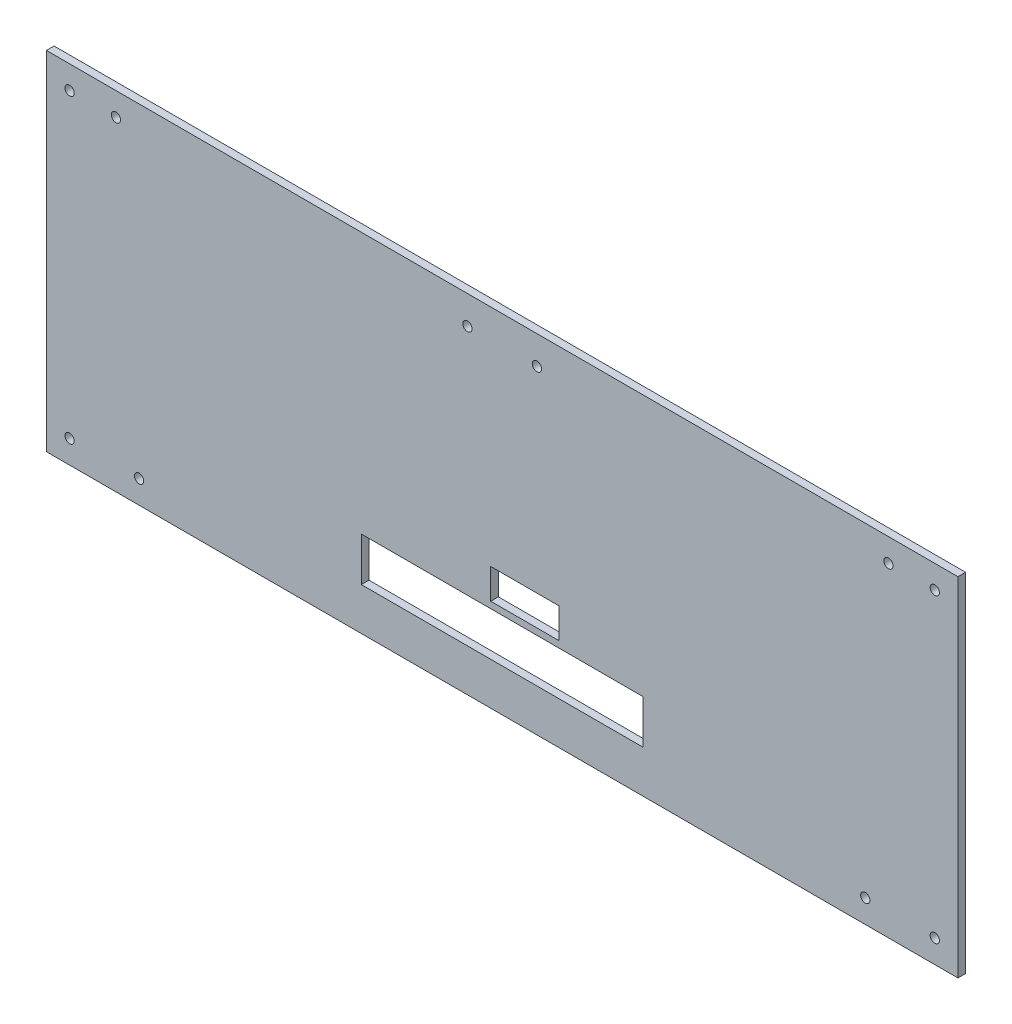
from build123d import *

# Parameters (mm, degrees)
SKETCH1_W           = 393.4
SKETCH1_H           = 150
BOSS_EXTRUDE1_DEPTH = 3.3
SKETCH2_R           = 2
CUT_EXTRUDE1_DEPTH  = 257.520622953
SKETCH3_R           = 2
CUT_EXTRUDE2_DEPTH  = 4
SKETCH4_R           = 2
CUT_EXTRUDE3_DEPTH  = 4
SKETCH6_W           = 29.5
SKETCH6_H           = 13
SKETCH6_W_2         = 121.579447476
SKETCH6_H_2         = 18.9
CUT_EXTRUDE4_DEPTH  = 10


with BuildPart() as part:
    # Sketch1 → Boss-Extrude1 (new body)
    with BuildSketch(Plane.XY):
        with Locations((27, -50.5)):
            Rectangle(SKETCH1_W, SKETCH1_H)
    extrude(amount=BOSS_EXTRUDE1_DEPTH)

    # Sketch2 → Cut-Extrude1 (cut, through all)
    with BuildSketch(Plane(origin=(0, 0, 0), x_dir=(-1, 0, 0), z_dir=(0, 0, -1))):
        with Locations((-183.7, -115.5)):
            Circle(SKETCH2_R)
        with Locations((-213.7, -115.5)):
            Circle(SKETCH2_R)
        with Locations((129.7, -115.5)):
            Circle(SKETCH2_R)
        with Locations((159.7, -115.5)):
            Circle(SKETCH2_R)
    extrude(amount=-CUT_EXTRUDE1_DEPTH, mode=Mode.SUBTRACT)

    # Sketch3 → Cut-Extrude2 (cut)
    with BuildSketch(Plane.XY.offset(3.3)):
        with Locations((-159.7, 14.5)):
            Circle(SKETCH3_R)
        with Locations((-139.7, 14.5)):
            Circle(SKETCH3_R)
        with Locations((193.7, 14.5)):
            Circle(SKETCH3_R)
        with Locations((213.7, 14.5)):
            Circle(SKETCH3_R)
    extrude(amount=-CUT_EXTRUDE2_DEPTH, mode=Mode.SUBTRACT)

    # Sketch4 → Cut-Extrude3 (cut)
    with BuildSketch(Plane.XY.offset(3.3)):
        with Locations((12, 12.25)):
            Circle(SKETCH4_R)
        with Locations((42, 12.25)):
            Circle(SKETCH4_R)
    extrude(amount=-CUT_EXTRUDE3_DEPTH, mode=Mode.SUBTRACT)

    # Sketch6 → Cut-Extrude4 (cut)
    with BuildSketch(Plane(origin=(0, 0, 0), x_dir=(-1, 0, 0), z_dir=(0, 0, -1))):
        with Locations((-36.8, -79)):
            Rectangle(SKETCH6_W, SKETCH6_H)
        with Locations((-27, -97.742382112)):
            Rectangle(SKETCH6_W_2, SKETCH6_H_2)
    extrude(amount=-CUT_EXTRUDE4_DEPTH, mode=Mode.SUBTRACT)


solid = part.part
